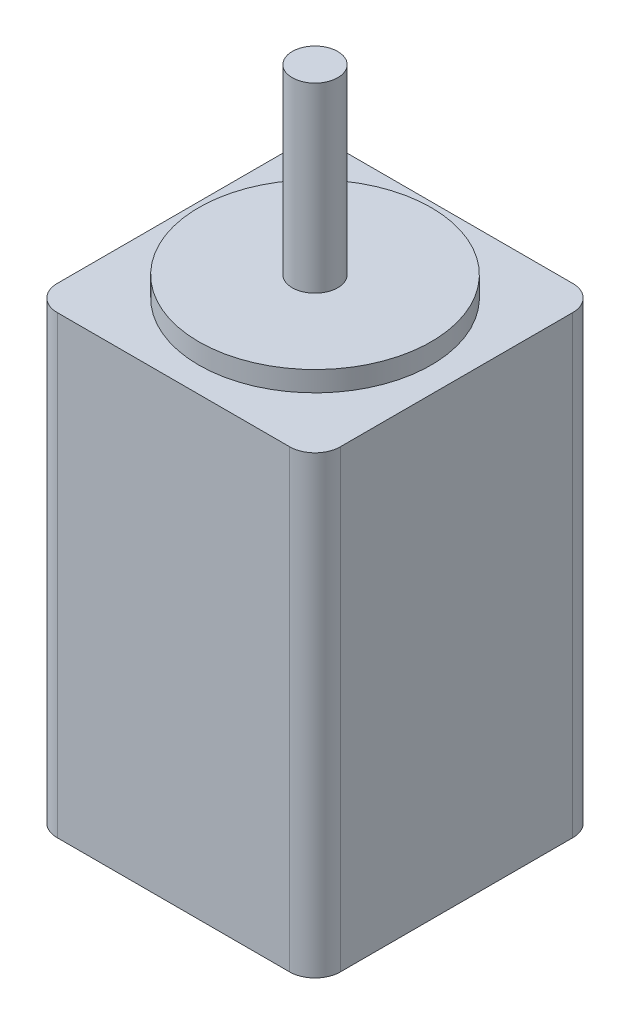
from build123d import *

# Parameters (mm, degrees)
SKETCH1_W           = 28
SKETCH1_H           = 28
BOSS_EXTRUDE1_DEPTH = 45
SKETCH2_R           = 11.5
BOSS_EXTRUDE2_DEPTH = 2
SKETCH3_R           = 2.25
BOSS_EXTRUDE3_DEPTH = 20
FILLET1_R           = 2.5


with BuildPart() as part:
    # Sketch1 → Boss-Extrude1 (new body)
    with BuildSketch(Plane(origin=(0, 0, 0), x_dir=(1, 0, 0), z_dir=(0, 1, 0))):
        Rectangle(SKETCH1_W, SKETCH1_H)
    extrude(amount=BOSS_EXTRUDE1_DEPTH)

    # Sketch2 → Boss-Extrude2 (add)
    with BuildSketch(Plane(origin=(0, 45, 0), x_dir=(1, 0, 0), z_dir=(0, 1, 0))):
        with Locations(Location((0, 0, 0), (0, 0, 90))):
            Circle(SKETCH2_R)
    extrude(amount=BOSS_EXTRUDE2_DEPTH)

    # Sketch3 → Boss-Extrude3 (add)
    with BuildSketch(Plane(origin=(0, 45, 0), x_dir=(1, 0, 0), z_dir=(0, 1, 0))):
        with Locations(Location((0, 0, 0), (0, 0, 270))):
            Circle(SKETCH3_R)
    extrude(amount=BOSS_EXTRUDE3_DEPTH)

    # Fillet1
    fillet1_edges = [part.edges().sort_by_distance(p)[0] for p in [
        (-14, 22.5, -14),
        (14, 22.5, -14),
        (14, 22.5, 14),
        (-14, 22.5, 14),
    ]]
    fillet(fillet1_edges, radius=FILLET1_R)


solid = part.part
